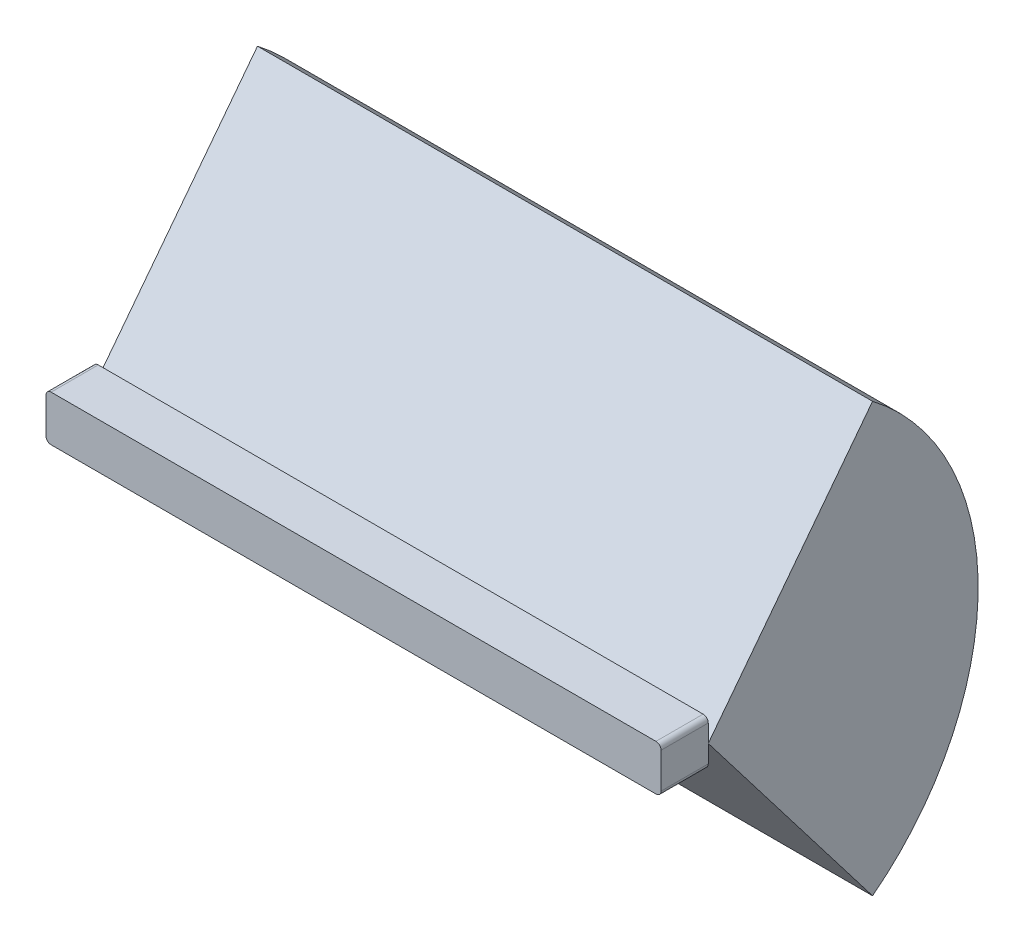
from build123d import *

# Parameters (mm, degrees)
BOSS_EXTRU_1_DEPTH = 92
BOSS_EXTRU_2_DEPTH = 1200


with BuildPart() as part:
    # Esquisse1 → Boss.-Extru.1 (new body)
    with BuildSketch(Plane.XY):
        with BuildLine():
            Line((-590, -44.5), (590, -44.5))
            ThreePointArc((590, -44.5), (597.071067812, -41.571067812), (600, -34.5))
            Line((600, -34.5), (600, 34.5))
            ThreePointArc((600, 34.5), (597.071067812, 41.571067812), (590, 44.5))
            Line((590, 44.5), (-590, 44.5))
            ThreePointArc((-590, 44.5), (-597.071067812, 41.571067812), (-600, 34.5))
            Line((-600, 34.5), (-600, -34.5))
            ThreePointArc((-600, -34.5), (-597.071067812, -41.571067812), (-590, -44.5))
        make_face()
    extrude(amount=BOSS_EXTRU_1_DEPTH)


with BuildPart() as body_2:
    # Esquisse3 → Boss.-Extru.2 (new, through all)
    with BuildSketch(Plane(origin=(600, 0, 0), x_dir=(0, 0, -1), z_dir=(1, 0, 0))):
        with BuildLine():
            Line((0, 0), (320.54421388, 417.741352646))
            ThreePointArc((320.54421388, 417.741352646), (526.551451202, 0), (320.54421388, -417.741352646))
            Line((320.54421388, -417.741352646), (0, 0))
        make_face()
    extrude(amount=-BOSS_EXTRU_2_DEPTH)


solid = Compound([part.part, body_2.part])
